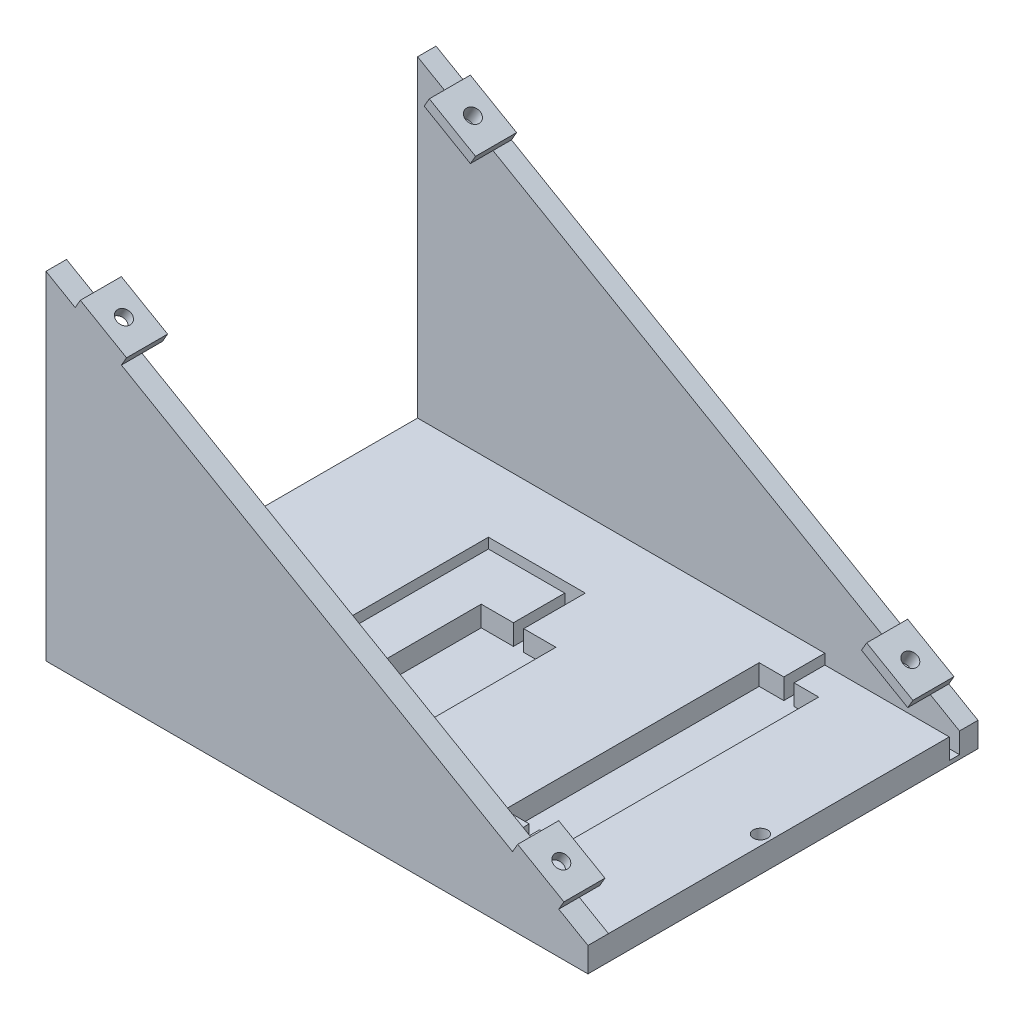
from build123d import *

# Parameters (mm, degrees)
SKETCH1_W           = 132
SKETCH1_H           = 95
BOSS_EXTRUDE1_DEPTH = 6
SKETCH3_W           = 10
SKETCH3_H           = 20
CUT_EXTRUDE2_DEPTH  = 10
CUT_EXTRUDE3_DEPTH  = 5
BOSS_EXTRUDE2_DEPTH = 4.5
BOSS_EXTRUDE3_DEPTH = 5
SKETCH9_R           = 1.75
CUT_EXTRUDE4_DEPTH  = 10
SKETCH10_W          = 13
SKETCH10_H          = 10
BOSS_EXTRUDE4_DEPTH = 2.5
SKETCH12_R          = 1.75
CUT_EXTRUDE6_DEPTH  = 4


with BuildPart() as part:
    # Sketch1 → Boss-Extrude1 (new body)
    with BuildSketch(Plane(origin=(0, 0, 0), x_dir=(1, 0, 0), z_dir=(0, 1, 0))):
        Rectangle(SKETCH1_W, SKETCH1_H)
    extrude(amount=BOSS_EXTRUDE1_DEPTH)

    # Sketch3 → Cut-Extrude2 (cut)
    with BuildSketch(Plane(origin=(0, 6, 0), x_dir=(1, 0, 0), z_dir=(0, 1, 0))):
        with Locations((-31, -19.5)):
            Rectangle(SKETCH3_W, SKETCH3_H)
    extrude(amount=-CUT_EXTRUDE2_DEPTH, mode=Mode.SUBTRACT)

    # Sketch4 → Cut-Extrude3 (cut)
    with BuildSketch(Plane(origin=(0, 6, 0), x_dir=(1, 0, 0), z_dir=(0, 1, 0))):
        Polygon((-11.15, 24), (-11.15, 11.5), (-19, 11.5), (-19, -29.5), (-11.15, -29.5), (-11.15, -39), (-8.65, -39), (33.2, -39), (35.7, -39), (35.7, -29), (41.7, -29), (41.7, 33), (35.7, 33), (35.7, 40.5), (66, 40.5), (66, 43), (35.7, 43), (33.2, 43), (33.2, 33), (27.2, 33), (27.2, -29), (33.2, -29), (33.2, -36.5), (-8.65, -36.5), (-8.65, -29.5), (-0.8, -29.5), (-0.8, 11.5), (-8.65, 11.5), (-8.65, 26.5), (-11.15, 26.5), (-32.25, 26.5), (-32.25, 24), (-32.25, -9.5), (-29.75, -9.5), (-29.75, 24), align=None)
    extrude(amount=-CUT_EXTRUDE3_DEPTH, mode=Mode.SUBTRACT)

    # Sketch6 → Boss-Extrude2 (add)
    with BuildSketch(Plane(origin=(0, 0, -47.5), x_dir=(-1, 0, 0), z_dir=(0, 0, -1))):
        Polygon((66, 6), (66, 82.210235533), (-66, 6), align=None)
    extrude(amount=-BOSS_EXTRUDE2_DEPTH)

    # Sketch7 → Boss-Extrude3 (add)
    with BuildSketch(Plane.XY.offset(47.5)):
        Polygon((-66, 6), (-66, 82.210235533), (66, 6), align=None)
    extrude(amount=-BOSS_EXTRUDE3_DEPTH)

    # Sketch9 → Cut-Extrude4 (cut)
    with BuildSketch(Plane.XZ):
        with Locations(Location((63.5, 3, 0), (0, 0, 270))):
            Circle(SKETCH9_R)
        with Locations(Location((-63.5, 3, 0), (0, 0, 90))):
            Circle(SKETCH9_R)
    extrude(amount=-CUT_EXTRUDE4_DEPTH, mode=Mode.SUBTRACT)

    # Sketch10 → Boss-Extrude4 (add)
    with BuildSketch(Plane(origin=(19.098076211, 33.078838325, 0), x_dir=(0.8660254037844417, -0.49999999999999495, 0), z_dir=(0.49999999999999495, 0.8660254037844417, 0))):
        with Locations((-83.552558883, 42.5)):
            Rectangle(SKETCH10_W, SKETCH10_H)
        with Locations((39.447441117, 42.5)):
            Rectangle(SKETCH10_W, SKETCH10_H)
        with Locations((-83.552558883, -42.5)):
            Rectangle(SKETCH10_W, SKETCH10_H)
        with Locations((39.447441117, -42.5)):
            Rectangle(SKETCH10_W, SKETCH10_H)
    extrude(amount=BOSS_EXTRUDE4_DEPTH)

    # Sketch12 → Cut-Extrude6 (cut)
    with BuildSketch(Plane(origin=(20.348076211, 35.243901834, 0), x_dir=(0.8660254037844417, -0.4999999999999949, 0), z_dir=(0.4999999999999949, 0.8660254037844417, 0))):
        with Locations(Location((39.447441117, 42.5, 0), (0, 0, 180))):
            Circle(SKETCH12_R)
        with Locations(Location((-83.552558883, 42.5, 0), (0, 0, 180))):
            Circle(SKETCH12_R)
        with Locations(Location((-83.552558883, -42.5, 0), (0, 0, 180))):
            Circle(SKETCH12_R)
        with Locations(Location((39.447441117, -42.5, 0), (0, 0, 180))):
            Circle(SKETCH12_R)
    extrude(amount=-CUT_EXTRUDE6_DEPTH, mode=Mode.SUBTRACT)


solid = part.part
